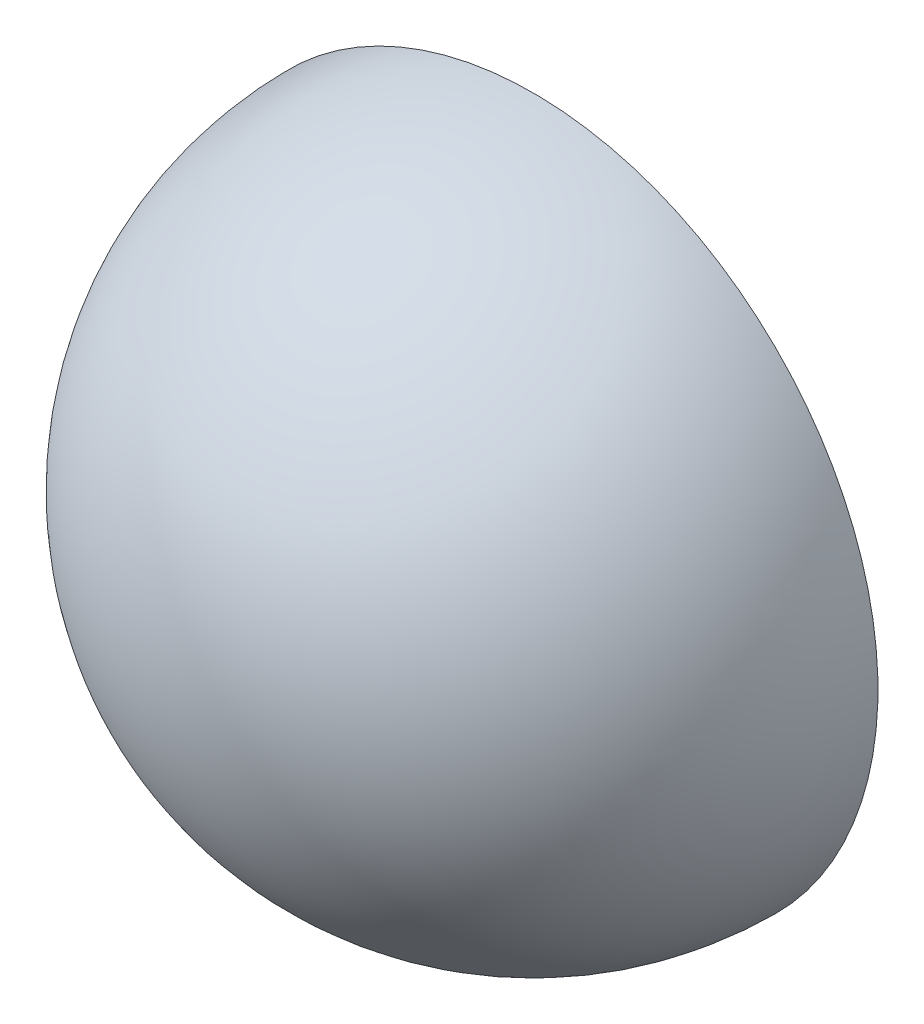
from build123d import *

# Parameters (mm, degrees)
REVOLVE1_ANGLE = 180


with BuildPart() as part:
    # Sketch1 → Revolve1 (revolve)
    with BuildSketch(Plane.XY):
        with BuildLine():
            Line((0, 25), (0, -25))
            ThreePointArc((0, -25), (25, 0), (0, 25))
        make_face()
    revolve(axis=Axis((0, 25, 0), (0, -1, 0)), revolution_arc=REVOLVE1_ANGLE)

    # Sketch2 → Cut-Revolve1 (revolve, cut)
    with BuildSketch(Plane(origin=(0, 0, 0), x_dir=(-1, 0, 0), z_dir=(0, 0, -1))):
        with BuildLine():
            Line((0, 15), (0, -15))
            ThreePointArc((0, -15), (15, 0), (0, 15))
        make_face()
    revolve(axis=Axis((0, 15, 0), (0, -1, 0)), mode=Mode.SUBTRACT)


solid = part.part
